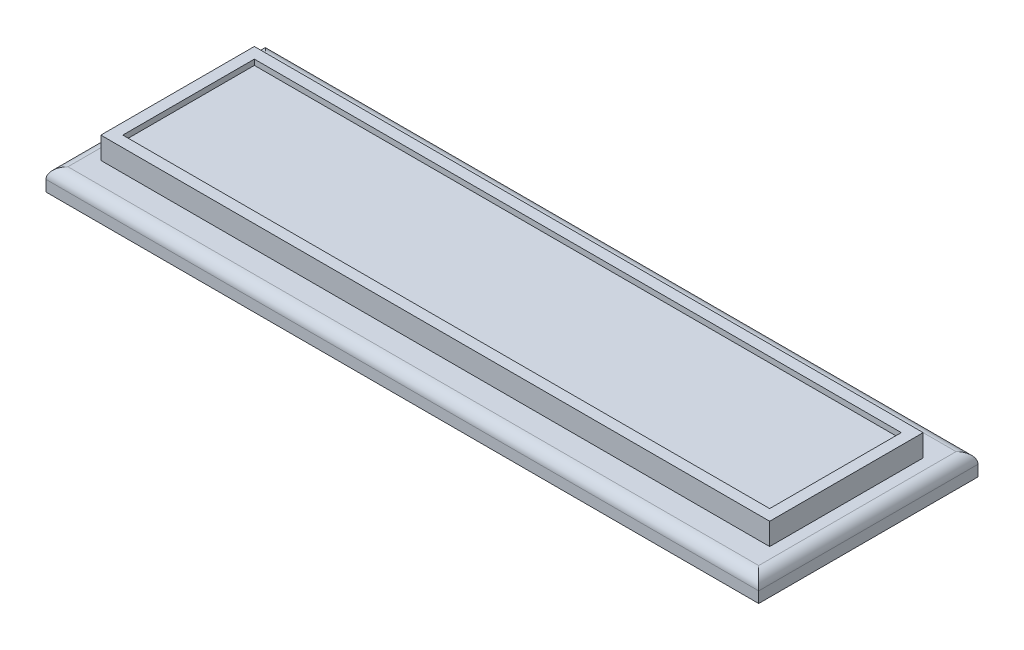
from build123d import *

# Parameters (mm, degrees)
ESBO_O1_W                = 65
ESBO_O1_H                = 20
RESSALTO_EXTRUS_O1_DEPTH = 2
ESBO_O2_W                = 61
ESBO_O2_H                = 14
RESSALTO_EXTRUS_O2_DEPTH = 2
ESBO_O3_W                = 59
ESBO_O3_H                = 12.003847287
CORTE_EXTRUS_O1_DEPTH    = 0.5
FILETE1_R                = 1


with BuildPart() as part:
    # Esboço1 → Ressalto-extrusão1 (new body)
    with BuildSketch(Plane(origin=(0, 0, 0), x_dir=(1, 0, 0), z_dir=(0, 1, 0))):
        with Locations((32.5, -10)):
            Rectangle(ESBO_O1_W, ESBO_O1_H)
    extrude(amount=RESSALTO_EXTRUS_O1_DEPTH)

    # Esboço2 → Ressalto-extrusão2 (add)
    with BuildSketch(Plane(origin=(0, 2, 0), x_dir=(1, 0, 0), z_dir=(0, 1, 0))):
        with Locations((32.5, -10)):
            Rectangle(ESBO_O2_W, ESBO_O2_H)
    extrude(amount=RESSALTO_EXTRUS_O2_DEPTH)

    # Esboço3 → Corte-extrusão1 (cut)
    with BuildSketch(Plane(origin=(0, 4, 0), x_dir=(1, 0, 0), z_dir=(0, 1, 0))):
        with Locations((32.5, -9.998076357)):
            Rectangle(ESBO_O3_W, ESBO_O3_H)
    extrude(amount=-CORTE_EXTRUS_O1_DEPTH, mode=Mode.SUBTRACT)

    # Filete1
    filete1_edges = [part.edges().sort_by_distance(p)[0] for p in [
        (65, 2, 10),
        (32.5, 2, 0),
        (0, 2, 10),
        (32.5, 2, 20),
    ]]
    fillet(filete1_edges, radius=FILETE1_R)


solid = part.part
